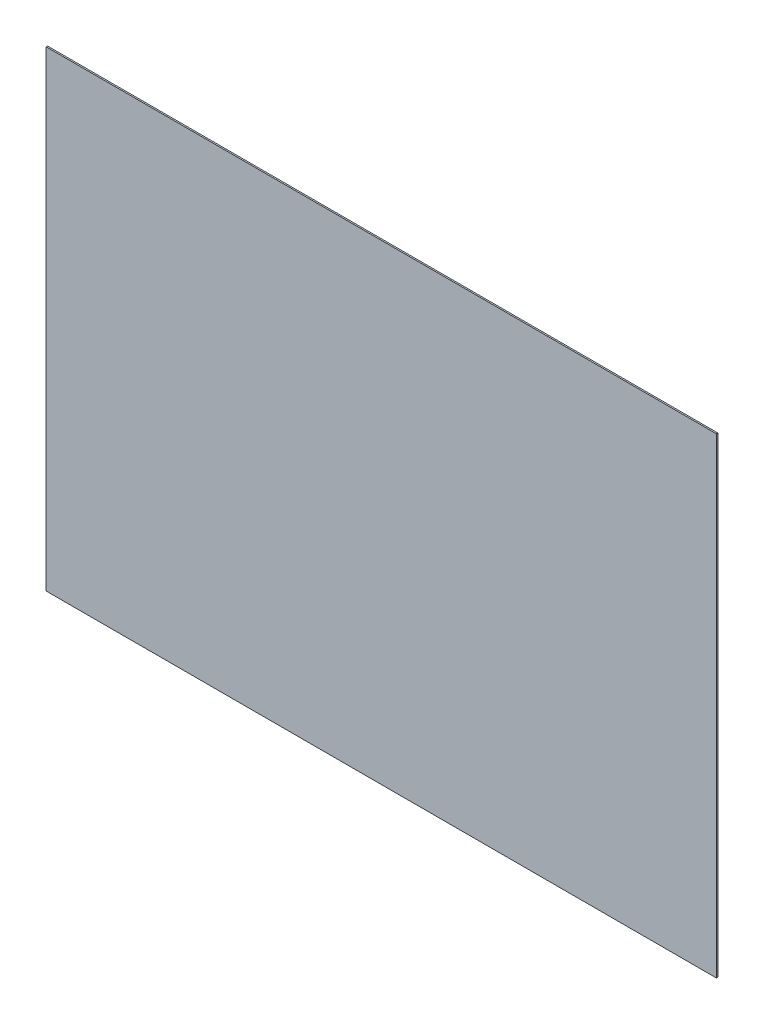
from build123d import *

# Parameters (mm, degrees)
SKETCH1_W           = 470
SKETCH1_H           = 330.5
BOSS_EXTRUDE1_DEPTH = 1


with BuildPart() as part:
    # Sketch1 → Boss-Extrude1 (new body)
    with BuildSketch(Plane.XY):
        with Locations((-180.199579832, 89.004201681)):
            Rectangle(SKETCH1_W, SKETCH1_H)
    extrude(amount=BOSS_EXTRUDE1_DEPTH)


solid = part.part
